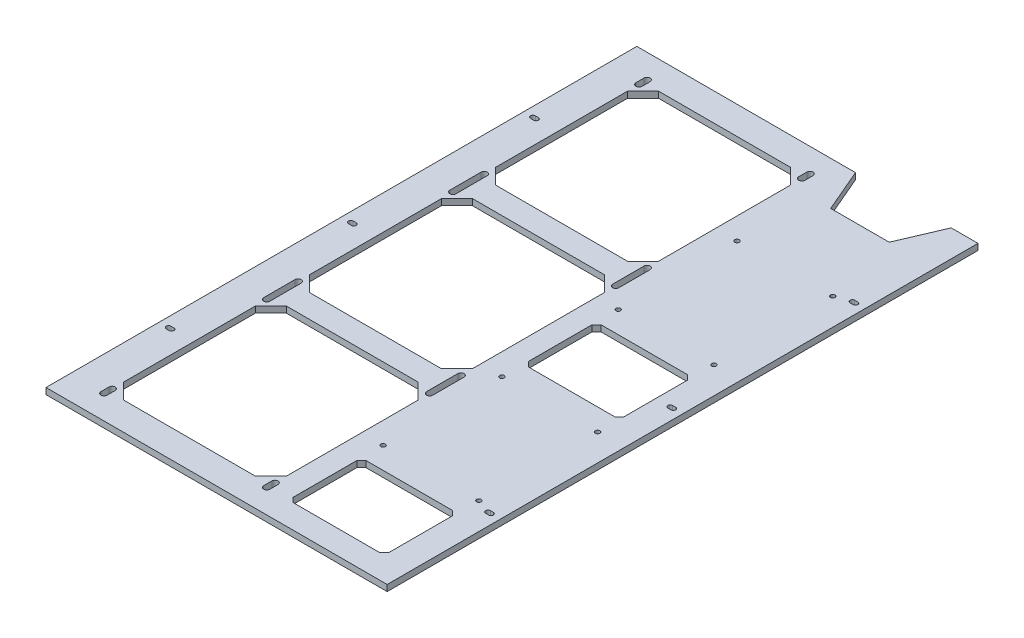
from build123d import *

# Parameters (mm, degrees)
SKETCH_1_W              = 220
SKETCH_1_H              = 381
EXTRUDE_1_DEPTH         = 4
F_3_0MM_1_D             = 3
CUT_EXTRUDE_7_DEPTH     = 221.014204087
CUT_EXTRUDE_8_DEPTH     = 221.014204087
HOLE_WIZARD_2_9_2_9_2_D = 2.9
CUT_EXTRUDE_5_DEPTH     = 221.014204087


with BuildPart() as part:
    # 草圖1 → 填料-伸長1 (new body)
    with BuildSketch(Plane(origin=(0, 0, 0), x_dir=(1, 0, 0), z_dir=(0, 1, 0))):
        Rectangle(SKETCH_1_W, SKETCH_1_H)
    extrude(amount=EXTRUDE_1_DEPTH)

    # Ø3.0mm 定位孔1 (through all)
    with Locations(Plane(origin=(-103, 4, -117.5), x_dir=(0, 0, 1), z_dir=(0, 1, 0))):
        with Locations((0, 0), (0, 206), (117.5, 206), (117.5, 0), (235, 206), (235, 0)):
            Hole(F_3_0MM_1_D / 2)

    # 草圖24 → 除料-伸長7 (cut, through all)
    with BuildSketch(Plane(origin=(0, 4, 0), x_dir=(1, 0, 0), z_dir=(0, 1, 0))):
        Polygon((17, 77.5), (7, 67.5), (-78, 67.5), (-88, 77.5), (-88, 162.5), (-78, 172.5), (7, 172.5), (17, 162.5), align=None)
        Polygon((-88, -42.5), (-78, -52.5), (7, -52.5), (17, -42.5), (17, 42.5), (7, 52.5), (-78, 52.5), (-88, 42.5), align=None)
        Polygon((-88, -162.5), (-78, -172.5), (7, -172.5), (17, -162.5), (17, -77.5), (7, -67.5), (-78, -67.5), (-88, -77.5), align=None)
        Polygon((34, -175.1), (89.72, -175.1), (92.72, -172.1), (92.72, -131.1), (89.72, -128.1), (34, -128.1), (31, -131.1), (31, -172.1), align=None)
        Polygon((34, -23.5), (89.72, -23.5), (92.72, -20.5), (92.72, 20.5), (89.72, 23.5), (34, 23.5), (31, 20.5), (31, -20.5), align=None)
        with BuildLine():
            Line((-90, -169.9), (-90, -175.1))
            ThreePointArc((-90, -175.1), (-88, -177.1), (-86, -175.1))
            Line((-86, -175.1), (-86, -169.9))
            ThreePointArc((-86, -169.9), (-88, -167.9), (-90, -169.9))
        make_face()
        with BuildLine():
            Line((15, -49.9), (15, -70.1))
            ThreePointArc((15, -70.1), (17, -72.1), (19, -70.1))
            Line((19, -70.1), (19, -49.9))
            ThreePointArc((19, -49.9), (17, -47.9), (15, -49.9))
        make_face()
        with BuildLine():
            Line((-90, -49.9), (-90, -70.1))
            ThreePointArc((-90, -70.1), (-88, -72.1), (-86, -70.1))
            Line((-86, -70.1), (-86, -49.9))
            ThreePointArc((-86, -49.9), (-88, -47.9), (-90, -49.9))
        make_face()
        with BuildLine():
            Line((19, 169.9), (19, 175.1))
            ThreePointArc((19, 175.1), (17, 177.1), (15, 175.1))
            Line((15, 175.1), (15, 169.9))
            ThreePointArc((15, 169.9), (17, 167.9), (19, 169.9))
        make_face()
        with BuildLine():
            Line((-86, 169.9), (-86, 175.1))
            ThreePointArc((-86, 175.1), (-88, 177.1), (-90, 175.1))
            Line((-90, 175.1), (-90, 169.9))
            ThreePointArc((-90, 169.9), (-88, 167.9), (-86, 169.9))
        make_face()
        with BuildLine():
            Line((19, -169.9), (19, -175.1))
            ThreePointArc((19, -175.1), (17, -177.1), (15, -175.1))
            Line((15, -175.1), (15, -169.9))
            ThreePointArc((15, -169.9), (17, -167.9), (19, -169.9))
        make_face()
        with BuildLine():
            Line((19, 70.1), (19, 49.9))
            ThreePointArc((19, 49.9), (17, 47.9), (15, 49.9))
            Line((15, 49.9), (15, 70.1))
            ThreePointArc((15, 70.1), (17, 72.1), (19, 70.1))
        make_face()
        with BuildLine():
            Line((-86, 70.1), (-86, 49.9))
            ThreePointArc((-86, 49.9), (-88, 47.9), (-90, 49.9))
            Line((-90, 49.9), (-90, 70.1))
            ThreePointArc((-90, 70.1), (-88, 72.1), (-86, 70.1))
        make_face()
    extrude(amount=-CUT_EXTRUDE_7_DEPTH, mode=Mode.SUBTRACT)

    # 草圖19 → 除料-伸長8 (cut, through all)
    with BuildSketch(Plane(origin=(0, 4, 0), x_dir=(1, 0, 0), z_dir=(0, 1, 0))):
        Polygon((31, 190.5), (37.6, 175.1), (86.12, 175.1), (92.72, 190.5), align=None)
        Polygon((86.12, 175.1), (37.6, 175.1), (43, 162.5), (80.72, 162.5), align=None)
    extrude(amount=-CUT_EXTRUDE_8_DEPTH, mode=Mode.SUBTRACT)

    # Ø2.9 (2.9) 直徑孔2 (through all)
    with Locations(Plane(origin=(0, 4, 0), x_dir=(1, 0, 0), z_dir=(0, 1, 0))):
        with Locations((31, 114.1), (92.72, 114.1), (31, 37.5), (92.72, 37.5), (31, -37.5), (92.72, -37.5), (31, -114.1), (92.72, -114.1)):
            Hole(HOLE_WIZARD_2_9_2_9_2_D / 2)

    # 草圖18 → 除料-伸長5 (cut, through all)
    with BuildSketch(Plane(origin=(0, 4, 0), x_dir=(1, 0, 0), z_dir=(0, 1, 0))):
        with BuildLine():
            Line((-104, 119), (-102, 119))
            ThreePointArc((-102, 119), (-100.5, 117.5), (-102, 116))
            Line((-102, 116), (-104, 116))
            ThreePointArc((-104, 116), (-105.5, 117.5), (-104, 119))
        make_face()
        with BuildLine():
            Line((102, 119), (104, 119))
            ThreePointArc((104, 119), (105.5, 117.5), (104, 116))
            Line((104, 116), (102, 116))
            ThreePointArc((102, 116), (100.5, 117.5), (102, 119))
        make_face()
        with BuildLine():
            Line((102, 1.5), (104, 1.5))
            ThreePointArc((104, 1.5), (105.5, 0), (104, -1.5))
            Line((104, -1.5), (102, -1.5))
            ThreePointArc((102, -1.5), (100.5, 0), (102, 1.5))
        make_face()
        with BuildLine():
            Line((102, -116), (104, -116))
            ThreePointArc((104, -116), (105.5, -117.5), (104, -119))
            Line((104, -119), (102, -119))
            ThreePointArc((102, -119), (100.5, -117.5), (102, -116))
        make_face()
        with BuildLine():
            Line((-104, 1.5), (-102, 1.5))
            ThreePointArc((-102, 1.5), (-100.5, 0), (-102, -1.5))
            Line((-102, -1.5), (-104, -1.5))
            ThreePointArc((-104, -1.5), (-105.5, 0), (-104, 1.5))
        make_face()
        with BuildLine():
            Line((-104, -116), (-102, -116))
            ThreePointArc((-102, -116), (-100.5, -117.5), (-102, -119))
            Line((-102, -119), (-104, -119))
            ThreePointArc((-104, -119), (-105.5, -117.5), (-104, -116))
        make_face()
    extrude(amount=-CUT_EXTRUDE_5_DEPTH, mode=Mode.SUBTRACT)


solid = part.part
